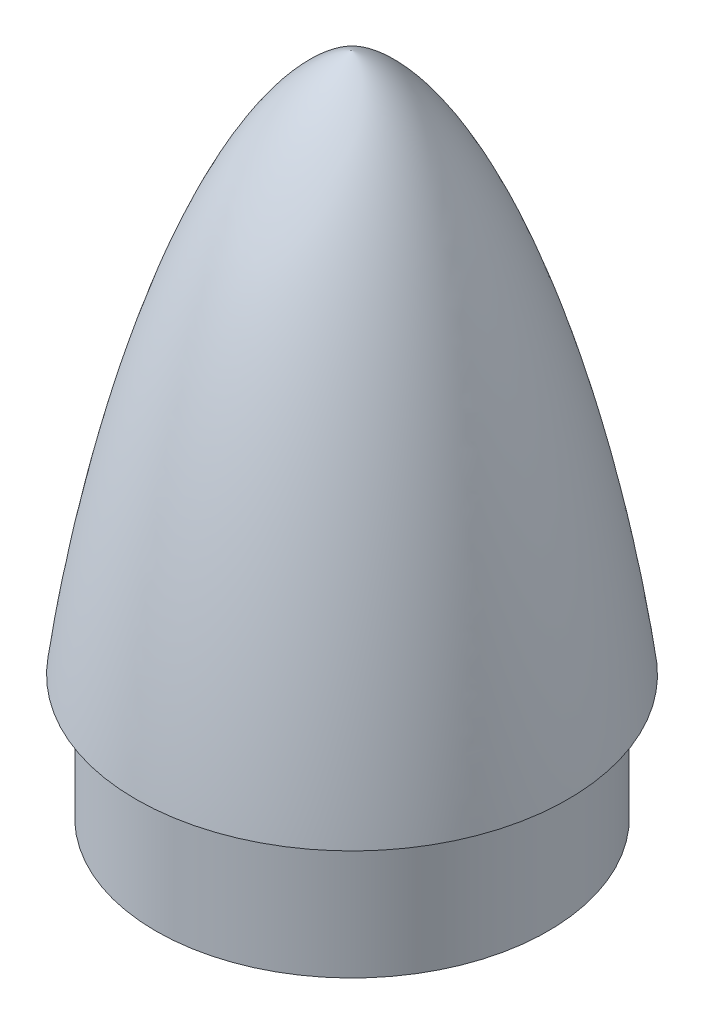
from build123d import *


with BuildPart() as part:
    # Sketch1 → Revolve1 (revolve)
    with BuildSketch(Plane(origin=(0, 0, 0), x_dir=(0, 0, -1), z_dir=(1, 0, 0)), mode=Mode.PRIVATE) as revolve1_sk:
        with BuildLine():
            add(Edge.make_bspline(
                [(-41.275, 663.718960604), (-37.114950299, 696.102091455), (-27.186253254, 738.275414141), (-13.47519543, 762.00972803), (0, 767)],
                knots=[0, 0, 0, 0, 0, 1, 1, 1, 1, 1], degree=4))
            Line((-41.275, 663.718960604), (-37.465, 663.718960604))
            Line((-37.465, 663.718960604), (-37.465, 640))
            Line((-37.465, 640), (-35.56, 640))
            Line((-35.56, 640), (-35.56, 663.718960604))
            Line((-35.56, 663.718960604), (-29.21, 663.718960604))
            Line((-29.21, 663.718960604), (-29.21, 665.750960604))
            Line((-29.21, 665.750960604), (-39.98737405, 665.750960604))
            add(Edge.make_bspline(
                [(-39.98737405, 665.750960604), (-36.477865751, 690.211377193), (-28.792209972, 725.630830687), (-11.299174439, 760.035001988), (0, 766)],
                knots=[0.018067753, 0.018067753, 0.018067753, 0.018067753, 0.67121294, 1, 1, 1, 1], degree=3))
            Line((0, 766), (0, 767))
        make_face()
    revolve(revolve1_sk.sketch.rotate(Axis((0, 663.718960604, 0), (0, 1, 0)), 180), axis=Axis((0, 663.718960604, 0), (0, 1, 0)))


solid = part.part
